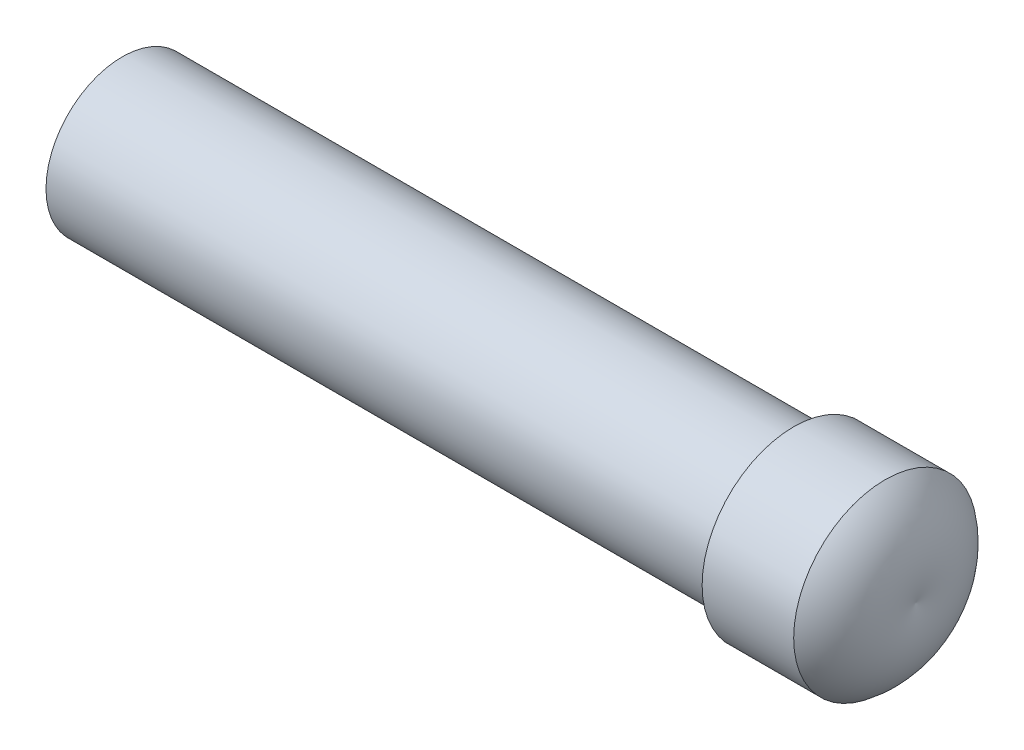
from build123d import *


with BuildPart() as part:
    # 草圖1 → 旋轉1 (revolve)
    with BuildSketch(Plane.XY, mode=Mode.PRIVATE) as revolve_1_sk:
        with BuildLine():
            Line((0, 0), (0, 12.5))
            Line((0, 12.5), (110, 12.5))
            Line((110, 12.5), (110, 15))
            Line((110, 15), (125, 15))
            ThreePointArc((125, 15), (129.886614683, 8.295538228), (130, 0))
            Line((130, 0), (0, 0))
        make_face()
    revolve(revolve_1_sk.sketch.rotate(Axis((0, 0, 0), (1, 0, 0)), 90), axis=Axis((0, 0, 0), (1, 0, 0)))


solid = part.part
